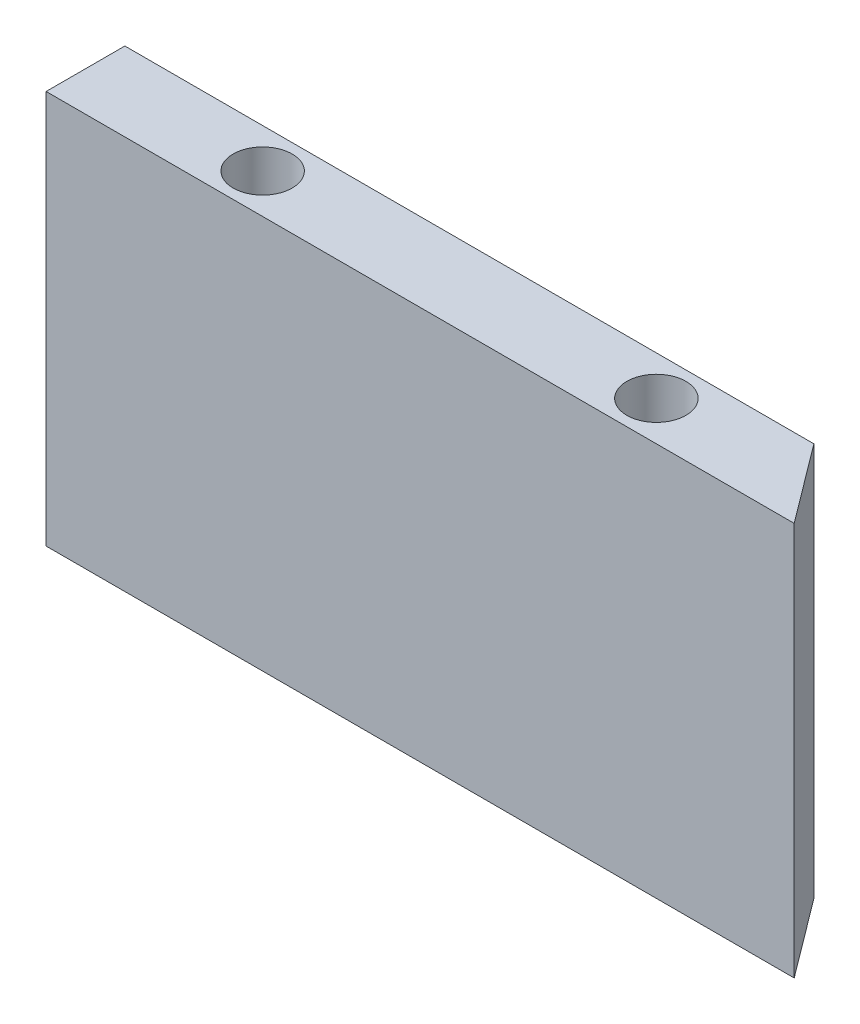
from build123d import *

# Parameters (mm, degrees)
BOSS_EXTRUDE2_DEPTH = 508
SKETCH5_R           = 38.1
CUT_EXTRUDE1_DEPTH  = 127
SKETCH7_R           = 40.852227979
SKETCH7_R_2         = 38.702110717
CUT_EXTRUDE2_DEPTH  = 127


with BuildPart() as part:
    # Sketch1 → Boss-Extrude2 (new body)
    with BuildSketch(Plane(origin=(0, 0, 0), x_dir=(1, 0, 0), z_dir=(0, 1, 0))):
        Polygon((-464.437614836, 50.8), (424.562385164, 50.8), (500.762385164, -50.8), (-464.437614836, -50.8), align=None)
    extrude(amount=BOSS_EXTRUDE2_DEPTH)

    # Sketch5 → Cut-Extrude1 (cut)
    with BuildSketch(Plane(origin=(0, 508, 0), x_dir=(1, 0, 0), z_dir=(0, 1, 0))):
        with Locations(Location((-235.837614836, 0, 0), (0, 0, 270))):
            Circle(SKETCH5_R)
        with Locations(Location((272.162385164, 0, 0), (0, 0, 270))):
            Circle(SKETCH5_R)
    extrude(amount=-CUT_EXTRUDE1_DEPTH, mode=Mode.SUBTRACT)

    # Sketch7 → Cut-Extrude2 (cut)
    with BuildSketch(Plane.XZ):
        with Locations(Location((-235.837614836, 0, 0), (0, 0, 270))):
            Circle(SKETCH7_R)
        with Locations(Location((272.162385164, 0, 0), (0, 0, 270))):
            Circle(SKETCH7_R_2)
    extrude(amount=-CUT_EXTRUDE2_DEPTH, mode=Mode.SUBTRACT)


solid = part.part
